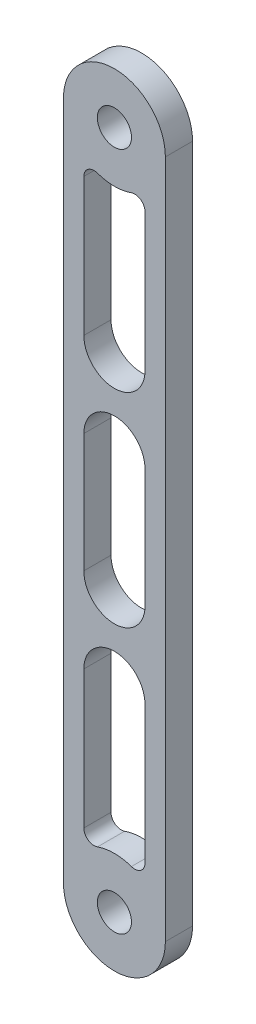
from build123d import *

# Parameters (mm, degrees)
SKETCH_1_R      = 5.025
EXTRUDE_1_DEPTH = 8


with BuildPart() as part:
    # 草图1 → 凸台-拉伸1 (new body)
    with BuildSketch(Plane.XY):
        with BuildLine():
            Line((-15, 0), (-15, -200))
            ThreePointArc((-15, -200), (0, -215), (15, -200))
            Line((15, -200), (15, 0))
            ThreePointArc((15, 0), (0, 15), (-15, 0))
        make_face()
        Circle(SKETCH_1_R, mode=Mode.SUBTRACT)
        with Locations((0, -200)):
            Circle(SKETCH_1_R, mode=Mode.SUBTRACT)
        with BuildLine():
            Line((-9, -16.970562748), (-9, -57.5))
            ThreePointArc((-9, -57.5), (0, -66.5), (9, -57.5))
            Line((9, -57.5), (9, -16.970562748))
            ThreePointArc((9, -16.970562748), (7.732050808, -14.521073006), (5, -14.142135624))
            ThreePointArc((5, -14.142135624), (0, -15), (-5, -14.142135624))
            ThreePointArc((-5, -14.142135624), (-7.732050808, -14.521073006), (-9, -16.970562748))
        make_face(mode=Mode.SUBTRACT)
        with BuildLine():
            Line((9, -82.5), (9, -117.5))
            ThreePointArc((9, -117.5), (0, -126.5), (-9, -117.5))
            Line((-9, -117.5), (-9, -82.5))
            ThreePointArc((-9, -82.5), (0, -73.5), (9, -82.5))
        make_face(mode=Mode.SUBTRACT)
        with BuildLine():
            Line((-9, -183.029437252), (-9, -142.5))
            ThreePointArc((-9, -142.5), (0, -133.5), (9, -142.5))
            Line((9, -142.5), (9, -183.029437252))
            ThreePointArc((9, -183.029437252), (7.732050808, -185.478926994), (5, -185.857864376))
            ThreePointArc((5, -185.857864376), (0, -185), (-5, -185.857864376))
            ThreePointArc((-5, -185.857864376), (-7.732050808, -185.478926994), (-9, -183.029437252))
        make_face(mode=Mode.SUBTRACT)
    extrude(amount=EXTRUDE_1_DEPTH)


solid = part.part
